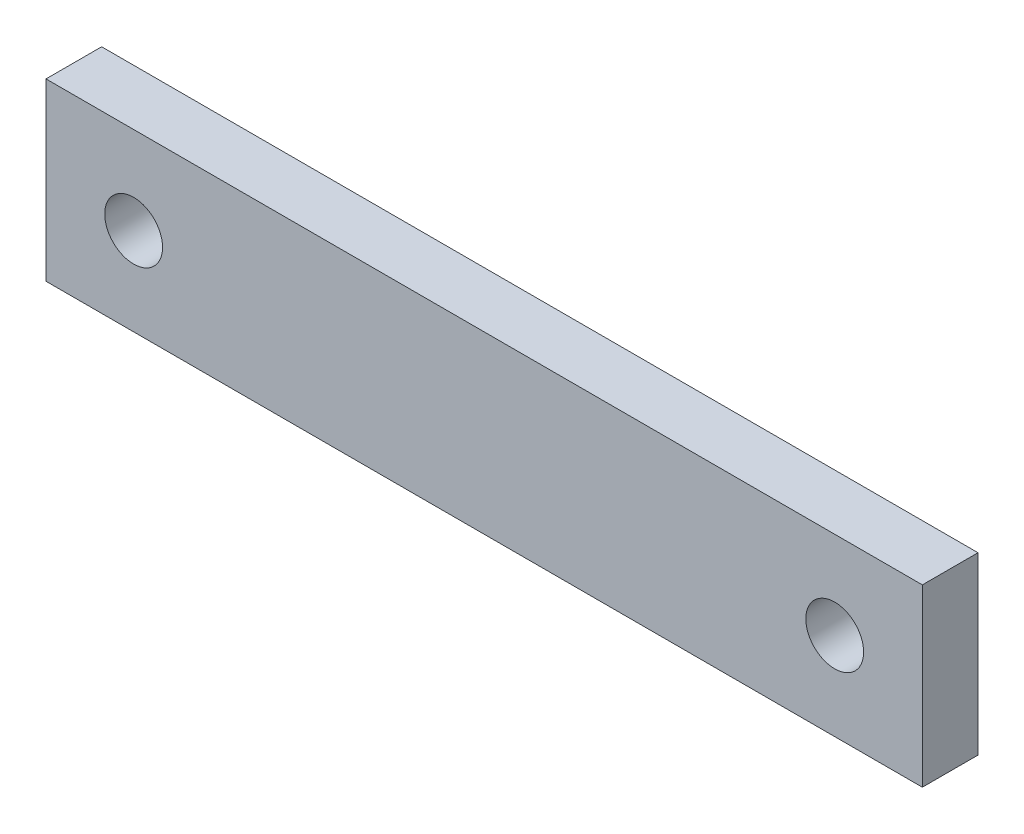
from build123d import *

# Parameters (mm, degrees)
SKETCH1_W           = 100
SKETCH1_H           = 20
SKETCH1_R           = 3.3
BOSS_EXTRUDE1_DEPTH = 3.175


with BuildPart() as part:
    # Sketch1 → Boss-Extrude1 (new, symmetric)
    with BuildSketch(Plane.XY):
        Rectangle(SKETCH1_W, SKETCH1_H)
        with Locations((-40, 0)):
            Circle(SKETCH1_R, mode=Mode.SUBTRACT)
        with Locations(Location((40, 0, 0), (0, 0, 180))):
            Circle(SKETCH1_R, mode=Mode.SUBTRACT)
    extrude(amount=BOSS_EXTRUDE1_DEPTH, both=True)


solid = part.part
